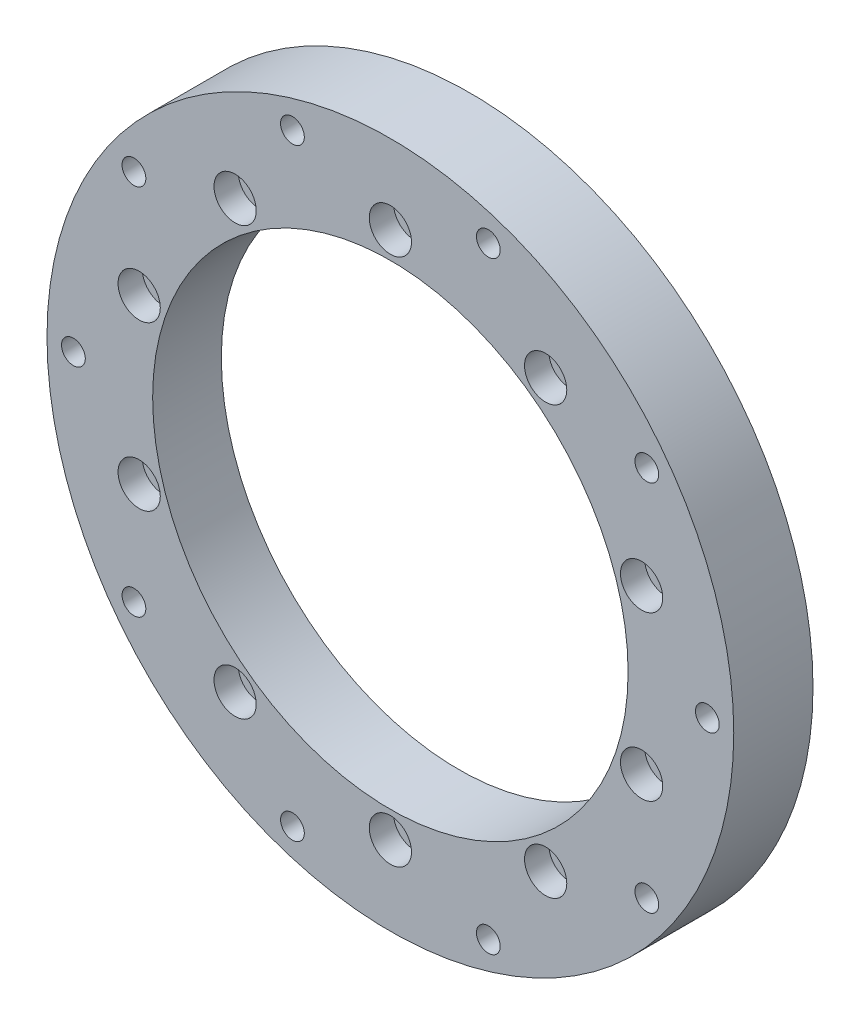
from build123d import *

# Parameters (mm, degrees)
SKETCH_1_R                = 65
EXTRUDE_1_DEPTH           = 15
SKETCH_2_R                = 45
CUT_EXTRUDE_1_DEPTH       = 15
SKETCH_3_R                = 53
CUT_EXTRUDE_2_DEPTH       = 2
HOLE_WIZARD_1_D           = 4.5
HOLE_WIZARD_1_CBORE_D     = 8
HOLE_WIZARD_1_CBORE_DEPTH = 4.6
PATTERN_CIRCULAR_1_COUNT  = 10
HOLE_WIZARD_2_D           = 4.5
HOLE_WIZARD_2_CBORE_D     = 8
HOLE_WIZARD_2_CBORE_DEPTH = 4.6
PATTERN_CIRCULAR_2_COUNT  = 10


with BuildPart() as part:
    # 草图1 → 凸台-拉伸1 (new body)
    with BuildSketch(Plane.XY):
        Circle(SKETCH_1_R)
    extrude(amount=EXTRUDE_1_DEPTH)

    # 草图2 → 切除-拉伸1 (cut)
    with BuildSketch(Plane(origin=(0, 0, 0), x_dir=(-1, 0, 0), z_dir=(0, 0, -1))):
        Circle(SKETCH_2_R)
    extrude(amount=-CUT_EXTRUDE_1_DEPTH, mode=Mode.SUBTRACT)

    # 草图3 → 切除-拉伸2 (cut)
    with BuildSketch(Plane(origin=(0, 0, 0), x_dir=(-1, 0, 0), z_dir=(0, 0, -1))):
        Circle(SKETCH_3_R)
    extrude(amount=-CUT_EXTRUDE_2_DEPTH, mode=Mode.SUBTRACT)

    # 打孔尺寸(%根据)内六角圆柱头螺钉的类型1 (through all)
    with Locations(Plane.XY.offset(15)):
        with Locations((0, 50)):
            hole_wizard_1 = CounterBoreHole(HOLE_WIZARD_1_D / 2, HOLE_WIZARD_1_CBORE_D / 2, HOLE_WIZARD_1_CBORE_DEPTH)

    # 阵列(圆周)1: 打孔尺寸(%根据)内六角圆柱头螺钉的类型1 ×10 about axis
    pattern_circular_1_axis = Axis((0, 0, 15), (0, 0, -1))
    for i in range(1, PATTERN_CIRCULAR_1_COUNT):
        add(hole_wizard_1.rotate(pattern_circular_1_axis, i * 360 / PATTERN_CIRCULAR_1_COUNT), mode=Mode.SUBTRACT)

    # 打孔尺寸(%根据)内六角圆柱头螺钉的类型2 (through all)
    with Locations(Plane(origin=(0, 0, 0), x_dir=(-1, 0, 0), z_dir=(0, 0, -1))):
        with Locations((-18.541019662, 57.063390978)):
            hole_wizard_2 = CounterBoreHole(HOLE_WIZARD_2_D / 2, HOLE_WIZARD_2_CBORE_D / 2, HOLE_WIZARD_2_CBORE_DEPTH)

    # 阵列(圆周)2: 打孔尺寸(%根据)内六角圆柱头螺钉的类型2 ×10 about axis
    pattern_circular_2_axis = Axis((0, 0, 15), (0, 0, -1))
    for i in range(1, PATTERN_CIRCULAR_2_COUNT):
        add(hole_wizard_2.rotate(pattern_circular_2_axis, i * 360 / PATTERN_CIRCULAR_2_COUNT), mode=Mode.SUBTRACT)


solid = part.part
